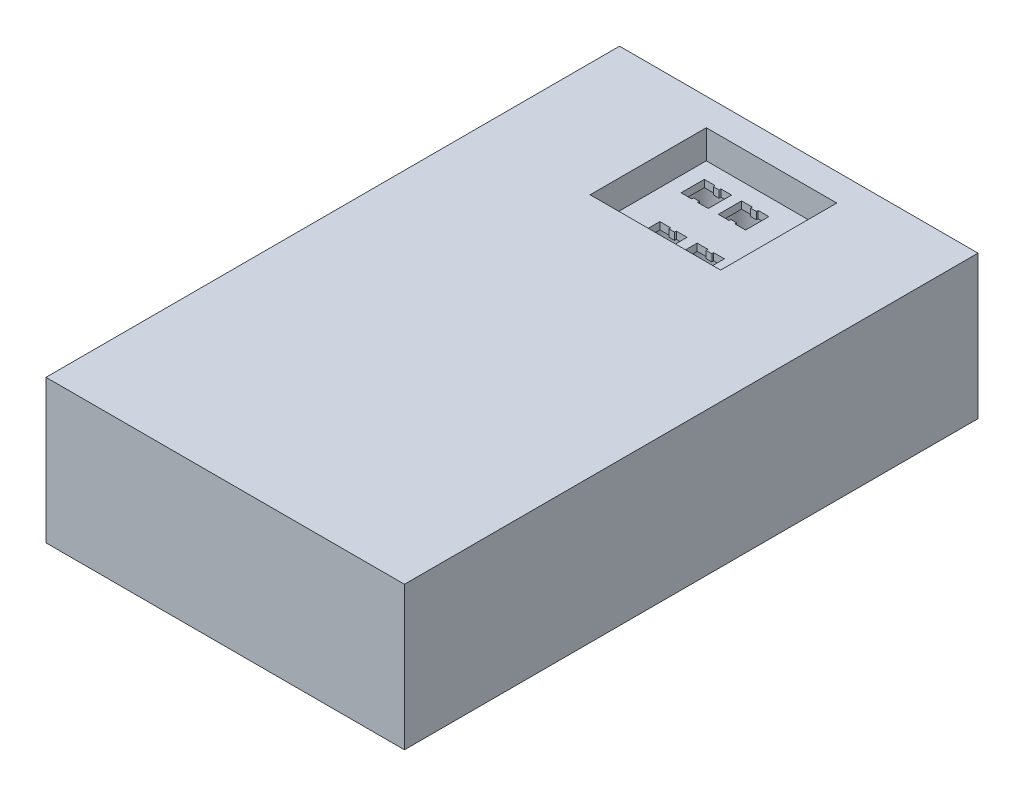
from build123d import *

# Parameters (mm, degrees)
SKETCH1_W           = 50
SKETCH1_H           = 20
BOSS_EXTRUDE1_DEPTH = 40
SKETCH2_W           = 18.2
SKETCH2_H           = 16.2
CUT_EXTRUDE1_DEPTH  = 4
CUT_EXTRUDE2_START  = -16
SKETCH3_R           = 2.5
CUT_EXTRUDE2_DEPTH  = 15
CUT_EXTRUDE3_DEPTH  = 1
CUT_EXTRUDE4_DEPTH  = 12
SKETCH7_W           = 18.2
SKETCH7_H           = 16.2
BOSS_EXTRUDE3_DEPTH = 1.5
CUT_EXTRUDE5_REACH  = 53.235
SKETCH8_R           = 1


with BuildPart() as part:
    # Sketch1 → Boss-Extrude1 (new, symmetric)
    with BuildSketch(Plane.XY):
        Rectangle(SKETCH1_W, SKETCH1_H)
    extrude(amount=BOSS_EXTRUDE1_DEPTH, both=True)

    # Sketch2 → Cut-Extrude1 (cut)
    with BuildSketch(Plane(origin=(0, 10, 0), x_dir=(1, 0, 0), z_dir=(0, 1, 0))):
        with Locations((0, 28.1)):
            Rectangle(SKETCH2_W, SKETCH2_H)
    extrude(amount=-CUT_EXTRUDE1_DEPTH, mode=Mode.SUBTRACT)

    # Sketch3 → Cut-Extrude2 (cut)
    with BuildSketch(Plane(origin=(0, 6, 0), x_dir=(1, 0, 0), z_dir=(0, 1, 0)).offset(CUT_EXTRUDE2_START)):
        with Locations(Location((-5.1, 32.2, 0), (0, 0, 180))):
            Circle(SKETCH3_R)
        with Locations(Location((0.1, 32.2, 0), (0, 0, 180))):
            Circle(SKETCH3_R)
        with Locations(Location((-3.1, 24, 0), (0, 0, 180))):
            Circle(SKETCH3_R)
        with Locations(Location((2.1, 24, 0), (0, 0, 180))):
            Circle(SKETCH3_R)
    extrude(amount=CUT_EXTRUDE2_DEPTH, mode=Mode.SUBTRACT)

    # Sketch4 → Cut-Extrude3 (cut)
    with BuildSketch(Plane(origin=(0, 6, 0), x_dir=(1, 0, 0), z_dir=(0, 1, 0))):
        Polygon((-5.5, 33.824807681), (-7, 33.824807681), (-7, 30.575192319), (-5.5, 30.575192319), (-5.5, 30.828384848), (-4.7, 30.828384848), (-4.7, 30.575192319), (-3.2, 30.575192319), (-3.2, 33.824807681), (-4.7, 33.824807681), (-4.7, 33.571615152), (-5.5, 33.571615152), align=None)
        Polygon((0.5, 30.575192319), (0.5, 30.828384848), (-0.3, 30.828384848), (-0.3, 30.575192319), (-1.8, 30.575192319), (-1.8, 33.824807681), (-0.3, 33.824807681), (-0.3, 33.571615152), (0.5, 33.571615152), (0.5, 33.824807681), (2, 33.824807681), (2, 30.575192319), align=None)
        Polygon((2.5, 22.375192325), (4.000000005, 22.375192325), (3.999999995, 25.624807687), (2.5, 25.624683497), (2.5, 25.371490969), (1.7, 25.371490983), (1.7, 25.624683512), (0.199999995, 25.624807675), (0.200000005, 22.375192313), (1.699999991, 22.37506815), (1.699999991, 22.628260678), (2.5, 22.628384854), align=None)
        Polygon((-3.5, 25.624683497), (-3.5, 25.371490969), (-2.7, 25.371490983), (-2.7, 25.624683512), (-1.199999995, 25.624807675), (-1.200000005, 22.375192313), (-2.699999991, 22.37506815), (-2.699999991, 22.628260678), (-3.5, 22.628384854), (-3.5, 22.375192325), (-5.000000005, 22.375192325), (-4.999999995, 25.624807687), align=None)
    extrude(amount=-CUT_EXTRUDE3_DEPTH, mode=Mode.SUBTRACT)

    # Sketch6 → Cut-Extrude4 (cut)
    with BuildSketch(Plane.XZ.offset(10)):
        Polygon((22.5, -36.2), (4, -36.2), (0, -36.2), (0, -29.2), (2.1, -29.2), (2.099999991, -20), (-3.1, -20), (-3.1, -29.2), (-5.1, -29.2), (-5.1, -36.2), (-9.1, -36.2), (-22.5, -36.2), (-22.5, 39), (22.5, 39), align=None)
    extrude(amount=-CUT_EXTRUDE4_DEPTH, mode=Mode.SUBTRACT)

    # Sketch7 → Boss-Extrude3 (add)
    with BuildSketch(Plane.XZ.offset(10)):
        with Locations((0, -28.1)):
            Rectangle(SKETCH7_W, SKETCH7_H)
    extrude(amount=-BOSS_EXTRUDE3_DEPTH)

    # Sketch8 → Cut-Extrude5 (cut, up to next)
    with BuildSketch(Plane.XZ.offset(10), mode=Mode.PRIVATE) as cut_extrude5_sk1:
        with Locations((-3.099999996, -24.000000006)):
            Circle(SKETCH8_R)
    cut_extrude5_tool1 = extrude(cut_extrude5_sk1.sketch, amount=-CUT_EXTRUDE5_REACH, mode=Mode.PRIVATE) & part.part
    # Sketch8 → Cut-Extrude5 (cut, up to next)
    with BuildSketch(Plane.XZ.offset(10), mode=Mode.PRIVATE) as cut_extrude5_sk2:
        with Locations((2.099999996, -24.000000006)):
            Circle(SKETCH8_R)
    cut_extrude5_tool2 = extrude(cut_extrude5_sk2.sketch, amount=-CUT_EXTRUDE5_REACH, mode=Mode.PRIVATE) & part.part
    # Sketch8 → Cut-Extrude5 (cut, up to next)
    with BuildSketch(Plane.XZ.offset(10), mode=Mode.PRIVATE) as cut_extrude5_sk3:
        with Locations((-5.1, -32.2)):
            Circle(SKETCH8_R)
    cut_extrude5_tool3 = extrude(cut_extrude5_sk3.sketch, amount=-CUT_EXTRUDE5_REACH, mode=Mode.PRIVATE) & part.part
    # Sketch8 → Cut-Extrude5 (cut, up to next)
    with BuildSketch(Plane.XZ.offset(10), mode=Mode.PRIVATE) as cut_extrude5_sk4:
        with Locations((0.1, -32.2)):
            Circle(SKETCH8_R)
    cut_extrude5_tool4 = extrude(cut_extrude5_sk4.sketch, amount=-CUT_EXTRUDE5_REACH, mode=Mode.PRIVATE) & part.part
    add(cut_extrude5_tool1.solids().sort_by_distance((-3.1, -10, -24))[0], mode=Mode.SUBTRACT)
    add(cut_extrude5_tool2.solids().sort_by_distance((2.1, -10, -24))[0], mode=Mode.SUBTRACT)
    add(cut_extrude5_tool3.solids().sort_by_distance((-5.1, -10, -32.2))[0], mode=Mode.SUBTRACT)
    add(cut_extrude5_tool4.solids().sort_by_distance((0.1, -10, -32.2))[0], mode=Mode.SUBTRACT)


solid = part.part
